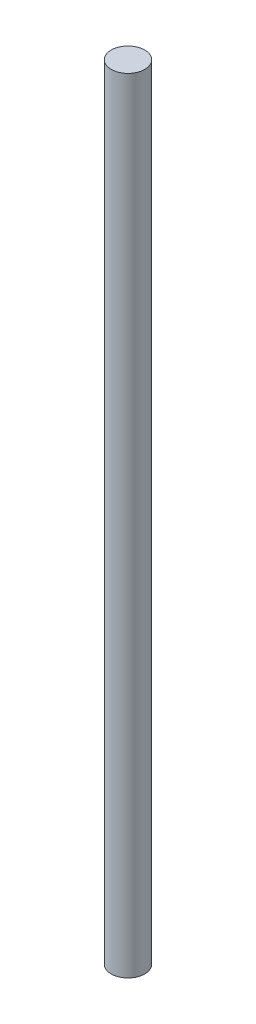
from build123d import *

# Parameters (mm, degrees)
IZIM4_R                     = 1.5
Y_KSEKLIK_EKSTR_ZYON2_DEPTH = 70


with BuildPart() as part:
    # Çizim4 → Yükseklik-Ekstrüzyon2 (new body)
    with BuildSketch(Plane(origin=(0, 0, 0), x_dir=(1, 0, 0), z_dir=(0, 1, 0))):
        with Locations(Location((0, 0, 0), (0, 0, 270))):
            Circle(IZIM4_R)
    extrude(amount=Y_KSEKLIK_EKSTR_ZYON2_DEPTH)


solid = part.part
